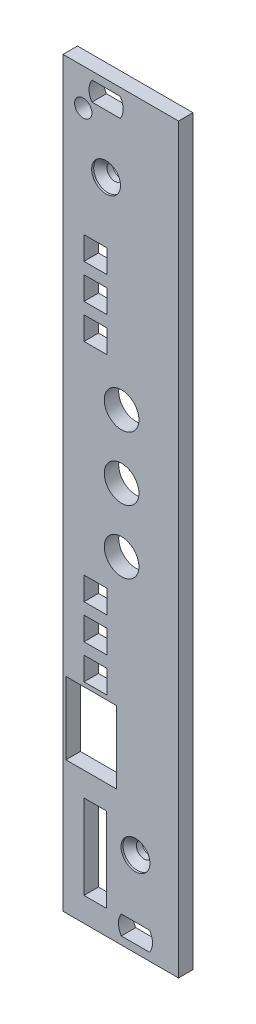
from build123d import *

# Parameters (mm, degrees)
SKETCH1_W                                      = 19.98
SKETCH1_H                                      = 128.4
BOSS_EXTRUDE1_DEPTH                            = 2.5
CUT_EXTRUDE1_DEPTH                             = 127.049239982
CUT_EXTRUDE2_DEPTH                             = 127.049239982
SKETCH4_W                                      = 3.9
SKETCH4_H                                      = 14.6
CUT_EXTRUDE3_DEPTH                             = 127.049239982
F_3_0_3_DIAMETER_HOLE1_D                       = 3
CSK_FOR_M2_5_FLAT_HEAD_MACHINE_SCREW1_AT_COUNT = 2
CSK_FOR_M2_5_FLAT_HEAD_MACHINE_SCREW1_AT_PITCH = 99.130249672
USB_DEPTH                                      = 127.049239982
SKETCH10_W                                     = 4
SKETCH10_H                                     = 4
MCXX_DEPTH                                     = 127.049239982
COPY_MMCX_1_COUNT                              = 3
COPY_MMCX_1_PITCH                              = 6
COPY_MMCX_2_COUNT                              = 2
COPY_MMCX_2_PITCH                              = 51
COPY_MMCX_2_COPY_1_SKETCH_W                    = 4
COPY_MMCX_2_COPY_1_SKETCH_H                    = 4
COPY_MMCX_2_COPY_1_DEPTH                       = 127.049239982
COPY_MMCX_2_COPY_2_SKETCH_W                    = 4
COPY_MMCX_2_COPY_2_SKETCH_H                    = 4
COPY_MMCX_2_COPY_2_DEPTH                       = 127.049239982
SKETCH12_R                                     = 3
SELECTOR_1_DEPTH                               = 127.049239982
LPATTERN3_COUNT                                = 3
LPATTERN3_PITCH                                = 11


with BuildPart() as part:
    # Sketch1 → Boss-Extrude1 (new body)
    with BuildSketch(Plane.XY.offset(2.5)):
        with Locations((2.54, 61.2)):
            Rectangle(SKETCH1_W, SKETCH1_H)
    extrude(amount=-BOSS_EXTRUDE1_DEPTH)

    # Sketch2 → Cut-Extrude1 (cut, through all)
    with BuildSketch(Plane.XY.offset(2.5)):
        with BuildLine():
            Line((2.445403852, 124.05), (-2.445403852, 124.05))
            ThreePointArc((-2.445403852, 124.05), (-2.95, 122.4), (-2.445403852, 120.75))
            Line((-2.445403852, 120.75), (2.445403852, 120.75))
            ThreePointArc((2.445403852, 120.75), (2.95, 122.4), (2.445403852, 124.05))
        make_face()
    extrude(amount=-CUT_EXTRUDE1_DEPTH, mode=Mode.SUBTRACT)

    # Sketch3 → Cut-Extrude2 (cut, through all)
    with BuildSketch(Plane.XY.offset(2.5)):
        with BuildLine():
            Line((7.525403852, 1.65), (2.634596148, 1.65))
            ThreePointArc((2.634596148, 1.65), (2.13, 0), (2.634596148, -1.65))
            Line((2.634596148, -1.65), (7.525403852, -1.65))
            ThreePointArc((7.525403852, -1.65), (8.03, 0), (7.525403852, 1.65))
        make_face()
    extrude(amount=-CUT_EXTRUDE2_DEPTH, mode=Mode.SUBTRACT)

    # Sketch4 → Cut-Extrude3 (cut, through all)
    with BuildSketch(Plane(origin=(0, 0, 0), x_dir=(-1, 0, 0), z_dir=(0, 0, -1))):
        with Locations((1.87, 8.5)):
            Rectangle(SKETCH4_W, SKETCH4_H)
    extrude(amount=-CUT_EXTRUDE3_DEPTH, mode=Mode.SUBTRACT)

    # Ø3.0 (3) Diameter Hole1 (through all)
    with Locations(Plane.XY.offset(2.5)):
        with Locations((-3.95, 119.1)):
            Hole(F_3_0_3_DIAMETER_HOLE1_D / 2)

    # Sketch7 → CSK for M2.5 Flat Head Machine Screw1 (revolve, cut)
    with BuildSketch(Plane(origin=(5.08, 11.7, 2.5), x_dir=(0, -1, 0), z_dir=(1, 0, 0))):
        Polygon((0, 0), (0, 2.5), (1.35, 2.5), (1.35, 1.5), (2.5, 0.35), (2.5, 0), align=None)
    csk_for_m2_5_flat_head_machine_screw1 = revolve(axis=Axis((5.08, 11.7, 8.85), (0, 0, -1)), mode=Mode.SUBTRACT)

    # CSK for M2.5 Flat Head Machine Screw1 at: CSK for M2.5 Flat Head Machine Screw1 ×2
    with Locations(*[Vector(-0.05124570972853528, 0.9986860754183062, 0) * (i * CSK_FOR_M2_5_FLAT_HEAD_MACHINE_SCREW1_AT_PITCH) for i in range(1, CSK_FOR_M2_5_FLAT_HEAD_MACHINE_SCREW1_AT_COUNT)]):
        add(csk_for_m2_5_flat_head_machine_screw1, mode=Mode.SUBTRACT)

    # Sketch9 → USB (cut, through all)
    with BuildSketch(Plane.XY.offset(2.5)):
        Polygon((-3.82, 19.95), (1.78, 19.95), (1.78, 32.45), (-3.82, 32.45), (-6.95, 32.45), (-6.95, 19.95), align=None)
    extrude(amount=-USB_DEPTH, mode=Mode.SUBTRACT)

    # Sketch10 → MCXX (cut, through all)
    with BuildSketch(Plane.XY.offset(2.5)):
        with Locations((-1.82, 35.2)):
            Rectangle(SKETCH10_W, SKETCH10_H)
    mcxx = extrude(amount=-MCXX_DEPTH, mode=Mode.SUBTRACT)

    # Copy MMCX 1: MCXX ×3
    with Locations(*[(0, i * COPY_MMCX_1_PITCH, 0) for i in range(1, COPY_MMCX_1_COUNT)]):
        add(mcxx, mode=Mode.SUBTRACT)

    # Copy MMCX 2: MCXX ×2
    with Locations(*[(0, i * COPY_MMCX_2_PITCH, 0) for i in range(1, COPY_MMCX_2_COUNT)]):
        add(mcxx, mode=Mode.SUBTRACT)

    # Copy MMCX 2 copy 1 sketch → Copy MMCX 2 copy 1 (cut, through all)
    with BuildSketch(Plane(origin=(0, 57, 2.5), x_dir=(1, 0, 0), z_dir=(0, 0, 1))):
        with Locations((-1.82, 35.2)):
            Rectangle(COPY_MMCX_2_COPY_1_SKETCH_W, COPY_MMCX_2_COPY_1_SKETCH_H)
    extrude(amount=-COPY_MMCX_2_COPY_1_DEPTH, mode=Mode.SUBTRACT)

    # Copy MMCX 2 copy 2 sketch → Copy MMCX 2 copy 2 (cut, through all)
    with BuildSketch(Plane(origin=(0, 63, 2.5), x_dir=(1, 0, 0), z_dir=(0, 0, 1))):
        with Locations((-1.82, 35.2)):
            Rectangle(COPY_MMCX_2_COPY_2_SKETCH_W, COPY_MMCX_2_COPY_2_SKETCH_H)
    extrude(amount=-COPY_MMCX_2_COPY_2_DEPTH, mode=Mode.SUBTRACT)

    # Sketch12 → Selector 1 (cut, through all)
    with BuildSketch(Plane.XY.offset(2.5)):
        with Locations((2.68, 55.2)):
            Circle(SKETCH12_R)
    selector_1 = extrude(amount=-SELECTOR_1_DEPTH, mode=Mode.SUBTRACT)

    # LPattern3: Selector 1 ×3
    with Locations(*[(0, i * LPATTERN3_PITCH, 0) for i in range(1, LPATTERN3_COUNT)]):
        add(selector_1, mode=Mode.SUBTRACT)


solid = part.part
